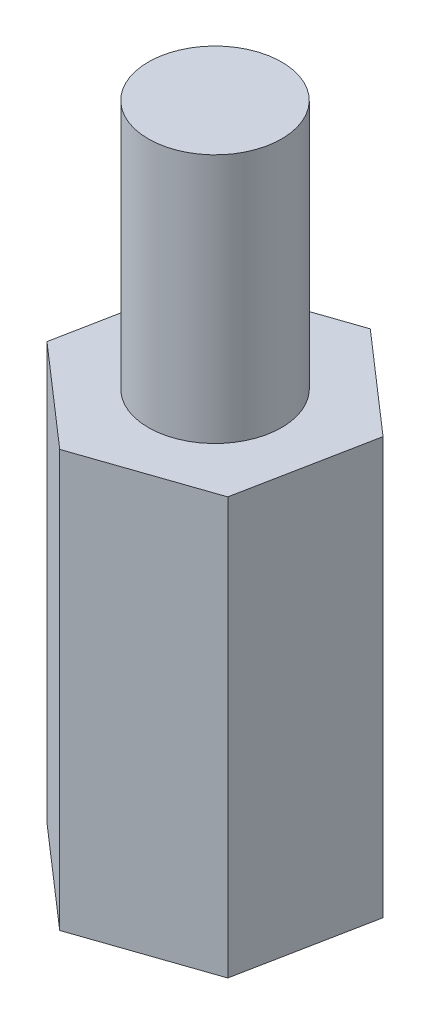
from build123d import *

# Parameters (mm, degrees)
SKETCH1_R           = 1.5
BOSS_EXTRUDE1_DEPTH = 10
SKETCH2_R           = 1.6
BOSS_EXTRUDE2_DEPTH = 6


with BuildPart() as part:
    # Sketch1 → Boss-Extrude1 (new body)
    with BuildSketch(Plane(origin=(0, 0, 0), x_dir=(1, 0, 0), z_dir=(0, 1, 0))):
        Polygon((3.004025535, 1.029156896), (0.610736751, 3.116140875), (-2.393288784, 2.086983979), (-3.004025535, -1.029156896), (-0.610736751, -3.116140875), (2.393288784, -2.086983979), align=None)
        with Locations(Location((0, 0, 0), (0, 0, 270))):
            Circle(SKETCH1_R, mode=Mode.SUBTRACT)
    extrude(amount=BOSS_EXTRUDE1_DEPTH)

    # Sketch2 → Boss-Extrude2 (add)
    with BuildSketch(Plane(origin=(0, 10, 0), x_dir=(1, 0, 0), z_dir=(0, 1, 0))):
        with Locations(Location((0, 0, 0), (0, 0, 270))):
            Circle(SKETCH2_R)
    extrude(amount=BOSS_EXTRUDE2_DEPTH)


solid = part.part
